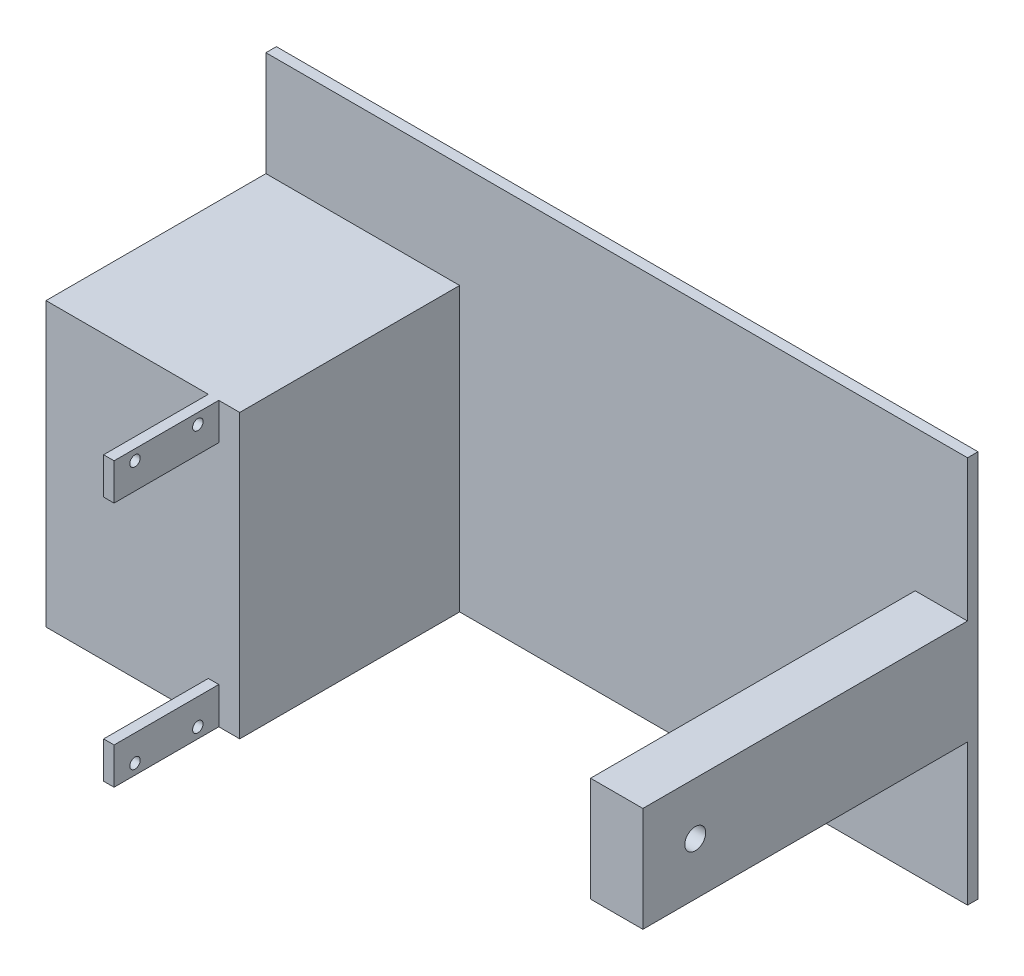
from build123d import *

# Parameters (mm, degrees)
SKETCH1_W           = 37
SKETCH1_H           = 54
BOSS_EXTRUDE1_DEPTH = 2
SKETCH2_W           = 2
SKETCH2_H           = 7
BOSS_EXTRUDE2_DEPTH = 20
CUT_EXTRUDE1_REACH  = 48.626
SKETCH3_R           = 1
SKETCH11_W          = 37
SKETCH11_H          = 54
SKETCH11_W_2        = 33
SKETCH11_H_2        = 50
BOSS_EXTRUDE5_DEPTH = 40
SKETCH12_W          = 134
SKETCH12_H          = 74
BOSS_EXTRUDE6_DEPTH = 2
SKETCH13_W          = 10
SKETCH13_H          = 20
BOSS_EXTRUDE7_DEPTH = 62
CUT_EXTRUDE2_REACH  = 150.084
SKETCH16_R          = 2


with BuildPart() as part:
    # Sketch1 → Boss-Extrude1 (new body)
    with BuildSketch(Plane.XY):
        Rectangle(SKETCH1_W, SKETCH1_H)
    extrude(amount=BOSS_EXTRUDE1_DEPTH)

    # Sketch2 → Boss-Extrude2 (add)
    with BuildSketch(Plane.XY.offset(2)):
        with Locations((13.5, -23.5)):
            Rectangle(SKETCH2_W, SKETCH2_H)
        with Locations((13.5, 23.5)):
            Rectangle(SKETCH2_W, SKETCH2_H)
    extrude(amount=BOSS_EXTRUDE2_DEPTH)

    # Sketch3 → Cut-Extrude1 (cut, up to next)
    with BuildSketch(Plane.ZY.offset(-12.5), mode=Mode.PRIVATE) as cut_extrude1_sk1:
        with Locations((6, -25)):
            Circle(SKETCH3_R)
    cut_extrude1_tool1 = extrude(cut_extrude1_sk1.sketch, amount=-CUT_EXTRUDE1_REACH, mode=Mode.PRIVATE) & part.part
    # Sketch3 → Cut-Extrude1 (cut, up to next)
    with BuildSketch(Plane.ZY.offset(-12.5), mode=Mode.PRIVATE) as cut_extrude1_sk2:
        with Locations((18, -25)):
            Circle(SKETCH3_R)
    cut_extrude1_tool2 = extrude(cut_extrude1_sk2.sketch, amount=-CUT_EXTRUDE1_REACH, mode=Mode.PRIVATE) & part.part
    # Sketch3 → Cut-Extrude1 (cut, up to next)
    with BuildSketch(Plane.ZY.offset(-12.5), mode=Mode.PRIVATE) as cut_extrude1_sk3:
        with Locations((6, 25)):
            Circle(SKETCH3_R)
    cut_extrude1_tool3 = extrude(cut_extrude1_sk3.sketch, amount=-CUT_EXTRUDE1_REACH, mode=Mode.PRIVATE) & part.part
    # Sketch3 → Cut-Extrude1 (cut, up to next)
    with BuildSketch(Plane.ZY.offset(-12.5), mode=Mode.PRIVATE) as cut_extrude1_sk4:
        with Locations((18, 25)):
            Circle(SKETCH3_R)
    cut_extrude1_tool4 = extrude(cut_extrude1_sk4.sketch, amount=-CUT_EXTRUDE1_REACH, mode=Mode.PRIVATE) & part.part
    add(cut_extrude1_tool1.solids().sort_by_distance((12.5, -25, 6))[0], mode=Mode.SUBTRACT)
    add(cut_extrude1_tool2.solids().sort_by_distance((12.5, -25, 18))[0], mode=Mode.SUBTRACT)
    add(cut_extrude1_tool3.solids().sort_by_distance((12.5, 25, 6))[0], mode=Mode.SUBTRACT)
    add(cut_extrude1_tool4.solids().sort_by_distance((12.5, 25, 18))[0], mode=Mode.SUBTRACT)

    # Sketch11 → Boss-Extrude5 (add)
    with BuildSketch(Plane(origin=(0, 0, 0), x_dir=(-1, 0, 0), z_dir=(0, 0, -1))):
        Rectangle(SKETCH11_W, SKETCH11_H)
        Rectangle(SKETCH11_W_2, SKETCH11_H_2, mode=Mode.SUBTRACT)
    extrude(amount=BOSS_EXTRUDE5_DEPTH)

    # Sketch12 → Boss-Extrude6 (add)
    with BuildSketch(Plane(origin=(0, 0, -40), x_dir=(-1, 0, 0), z_dir=(0, 0, -1))):
        with Locations((-48.5, 10)):
            Rectangle(SKETCH12_W, SKETCH12_H)
    extrude(amount=BOSS_EXTRUDE6_DEPTH)

    # Sketch13 → Boss-Extrude7 (add)
    with BuildSketch(Plane.XY.offset(-40)):
        with Locations((110.5, 10)):
            Rectangle(SKETCH13_W, SKETCH13_H)
    extrude(amount=BOSS_EXTRUDE7_DEPTH)

    # Sketch16 → Cut-Extrude2 (cut, up to next)
    with BuildSketch(Plane(origin=(115.5, 0, 0), x_dir=(0, 0, -1), z_dir=(1, 0, 0)), mode=Mode.PRIVATE) as cut_extrude2_sk1:
        with Locations((-12, 10)):
            Circle(SKETCH16_R)
    cut_extrude2_tool1 = extrude(cut_extrude2_sk1.sketch, amount=-CUT_EXTRUDE2_REACH, mode=Mode.PRIVATE) & part.part
    add(cut_extrude2_tool1.solids().sort_by_distance((115.5, 10, 12))[0], mode=Mode.SUBTRACT)


solid = part.part
